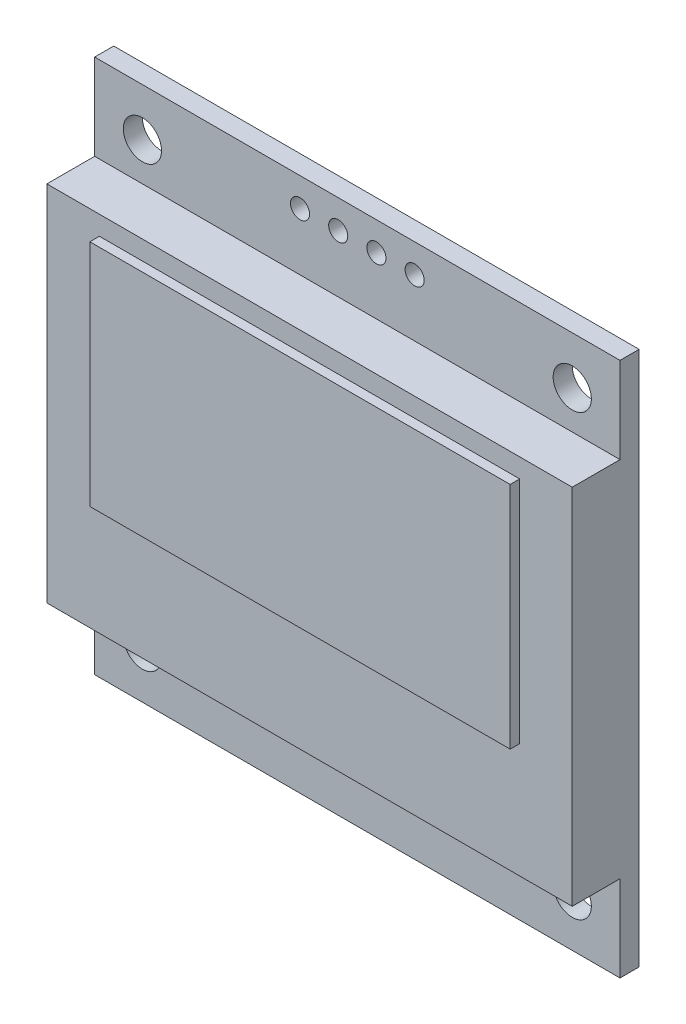
from build123d import *

# Parameters (mm, degrees)
SKETCH1_W           = 27.5
SKETCH1_H           = 19
SKETCH1_W_2         = 22
SKETCH1_H_2         = 12
BOSS_EXTRUDE1_DEPTH = 3.5
SKETCH1_3_W         = 27.5
SKETCH1_3_H         = 4.5
SKETCH1_3_R         = 1
SKETCH1_3_R_2       = 0.5
BOSS_EXTRUDE2_DEPTH = 1
SKETCH1_4_W         = 22
SKETCH1_4_H         = 12
BOSS_EXTRUDE3_DEPTH = 4


with BuildPart() as part:
    # Sketch1 → Boss-Extrude1 (new body)
    with BuildSketch(Plane.XY):
        with Locations((13.75, -10.552238806)):
            Rectangle(SKETCH1_W, SKETCH1_H)
        with Locations((13.75, -8.052238806)):
            Rectangle(SKETCH1_W_2, SKETCH1_H_2, mode=Mode.SUBTRACT)
    extrude(amount=BOSS_EXTRUDE1_DEPTH)

    # Sketch1<3> → Boss-Extrude2 (add)
    # profile 1 of 2: a face of its own
    with BuildSketch(Plane.XY):
        with Locations((13.75, 1.197761194)):
            Rectangle(SKETCH1_3_W, SKETCH1_3_H)
        with Locations((2.5, 0.947761194)):
            Circle(SKETCH1_3_R, mode=Mode.SUBTRACT)
        with Locations((10.75, 1.947761194)):
            Circle(SKETCH1_3_R_2, mode=Mode.SUBTRACT)
        with Locations((12.75, 1.947761194)):
            Circle(SKETCH1_3_R_2, mode=Mode.SUBTRACT)
        with Locations((14.75, 1.947761194)):
            Circle(SKETCH1_3_R_2, mode=Mode.SUBTRACT)
        with Locations((16.75, 1.947761194)):
            Circle(SKETCH1_3_R_2, mode=Mode.SUBTRACT)
        with Locations((25, 0.947761194)):
            Circle(SKETCH1_3_R, mode=Mode.SUBTRACT)
    # profile 2 of 2: a face of its own
    with BuildSketch(Plane.XY):
        with Locations((13.75, -22.302238806)):
            Rectangle(SKETCH1_3_W, SKETCH1_3_H)
        with Locations((2.5, -22.052238806)):
            Circle(SKETCH1_3_R, mode=Mode.SUBTRACT)
        with Locations((25, -22.052238806)):
            Circle(SKETCH1_3_R, mode=Mode.SUBTRACT)
    extrude(amount=BOSS_EXTRUDE2_DEPTH)

    # Sketch1<4> → Boss-Extrude3 (add)
    with BuildSketch(Plane.XY):
        with Locations((13.75, -8.052238806)):
            Rectangle(SKETCH1_4_W, SKETCH1_4_H)
    extrude(amount=BOSS_EXTRUDE3_DEPTH)


solid = part.part
